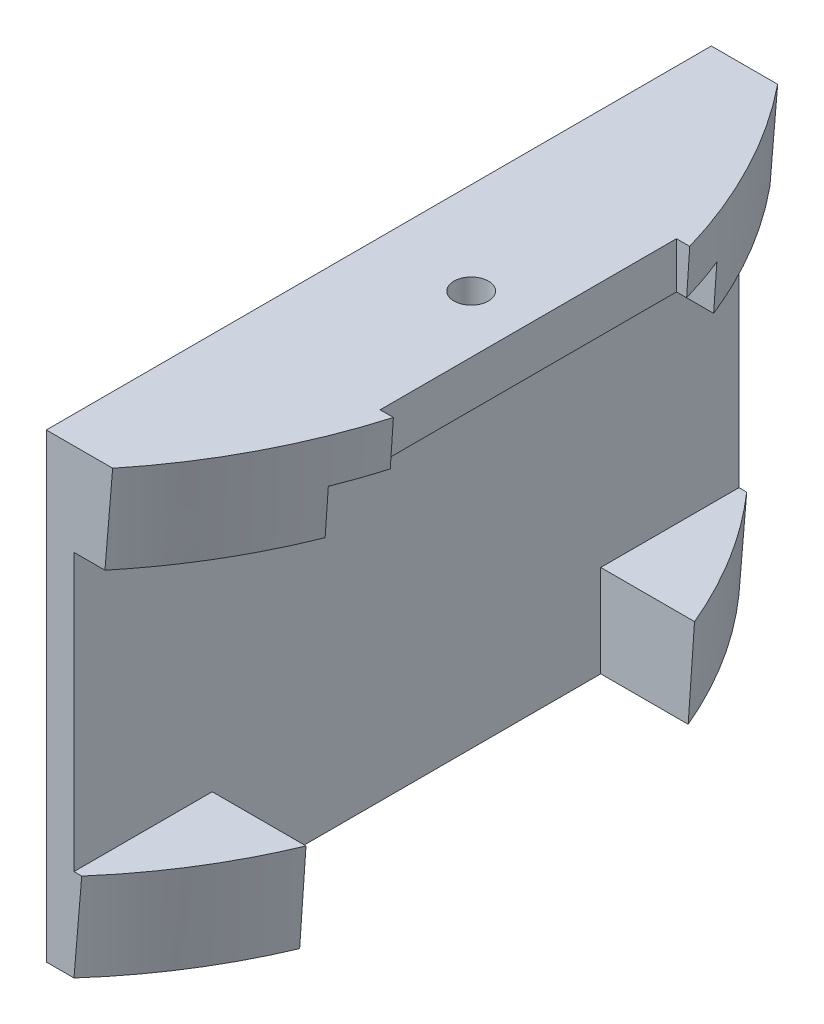
from build123d import *

# Parameters (mm, degrees)
CUT_EXTRUDE1_DEPTH      = 57.15
CUT_EXTRUDE2_DEPTH      = 57.15
CUT_EXTRUDE3_DEPTH      = 106.018320578
CUT_EXTRUDE3_DEPTH_BACK = 106.018320578
SKETCH7_W               = 43.8822002
SKETCH7_H               = 38.1
SKETCH8_R               = 2.38125
CUT_EXTRUDE4_DEPTH      = 57.15


with BuildPart() as part:
    # Sketch1 for Loft1 → Loft1 section 0
    with BuildSketch(Plane(origin=(0, 0, 0), x_dir=(1, 0, 0), z_dir=(0, 1, 0))):
        with BuildLine():
            Line((47.55805847, 45.81966963), (47.55805847, -45.81966963))
            Line((47.55805847, -45.81966963), (51.36805847, -45.81966963))
            # circular arc as an exact rational Bezier (weights 1, cos(half-angle), 1)
            Bezier((51.36805847, -45.81966963), (92.238634224, 0), (51.36805847, 45.81966963), weights=[1, 0.746259966, 1])
            Line((51.36805847, 45.81966963), (47.55805847, 45.81966963))
        make_face()
    # Sketch2 for Loft1 → Loft1 section 1
    with BuildSketch(Plane(origin=(0, 63.5, 0), x_dir=(1, 0, 0), z_dir=(0, 1, 0))):
        with BuildLine():
            Line((47.55805847, 45.81966963), (47.55805847, -45.81966963))
            Line((47.55805847, -45.81966963), (56.698115303, -45.81966963))
            Bezier((56.698115303, -45.81966963), (93.726544094, 0), (56.698115303, 45.81966963), weights=[1, 0.777773263, 1])
            Line((56.698115303, 45.81966963), (47.55805847, 45.81966963))
        make_face()
    loft()

    # Sketch5 → Cut-Extrude1 (cut)
    with BuildSketch(Plane.XZ):
        with BuildLine():
            ThreePointArc((63.415332088, -26.76966963), (68.834, 0), (63.415332088, 26.76966963))
            Line((63.415332088, 26.76966963), (51.36805847, 26.76966963))
            Line((51.36805847, 26.76966963), (51.36805847, -26.76966963))
            Line((51.36805847, -26.76966963), (63.415332088, -26.76966963))
        make_face()
        with BuildLine():
            Line((102.991666241, 26.76966963), (63.415332088, 26.76966963))
            ThreePointArc((63.415332088, 26.76966963), (68.834, 0), (63.415332088, -26.76966963))
            Line((63.415332088, -26.76966963), (102.991666241, -26.76966963))
            Line((102.991666241, -26.76966963), (102.991666241, 26.76966963))
        make_face()
    extrude(amount=-CUT_EXTRUDE1_DEPTH, mode=Mode.SUBTRACT)

    # Sketch6 → Cut-Extrude2 (cut)
    with BuildSketch(Plane(origin=(0, 63.5, 0), x_dir=(1, 0, 0), z_dir=(0, 1, 0))):
        with BuildLine():
            Line((103.737826736, 20.41966963), (69.979679166, 20.41966963))
            add(Edge.make_bspline(
                [(69.979679166, -20.419669631), (75.938021828, 0), (69.979679166, 20.419669631)],
                knots=[0.297886949, 0.297886949, 0.297886949, 0.702113051, 0.702113051, 0.702113051], degree=2, weights=[0.907042416, 0.870730847, 0.907042416]))
            Line((69.979679166, -20.41966963), (103.737826736, -20.41966963))
            Line((103.737826736, -20.41966963), (103.737826736, 20.41966963))
        make_face()
        with BuildLine():
            add(Edge.make_bspline(
                [(69.979679166, -20.419669631), (75.938021828, 0), (69.979679166, 20.419669631)],
                knots=[0.297886949, 0.297886949, 0.297886949, 0.702113051, 0.702113051, 0.702113051], degree=2, weights=[0.907042416, 0.870730847, 0.907042416]))
            Line((69.979679166, 20.41966963), (68.152482199, 20.41966963))
            Line((68.152482199, 20.41966963), (68.152482199, -20.41966963))
            Line((68.152482199, -20.41966963), (69.979679166, -20.41966963))
        make_face()
    extrude(amount=-CUT_EXTRUDE2_DEPTH, mode=Mode.SUBTRACT)

    # Sketch7 → Cut-Extrude3 (cut, two sides: drawn at the far end of the back side and taken through both)
    with BuildSketch(Plane.XY.offset(-CUT_EXTRUDE3_DEPTH_BACK)):
        with Locations((73.30915857, 31.75)):
            Rectangle(SKETCH7_W, SKETCH7_H)
    extrude(amount=CUT_EXTRUDE3_DEPTH + CUT_EXTRUDE3_DEPTH_BACK, mode=Mode.SUBTRACT)

    # Sketch8 → Cut-Extrude4 (cut)
    with BuildSketch(Plane.XZ.offset(-57.15)):
        with Locations(Location((60.25805847, -0.02733037, 0), (0, 0, 270))):
            Circle(SKETCH8_R)
    extrude(amount=-CUT_EXTRUDE4_DEPTH, mode=Mode.SUBTRACT)


solid = part.part
